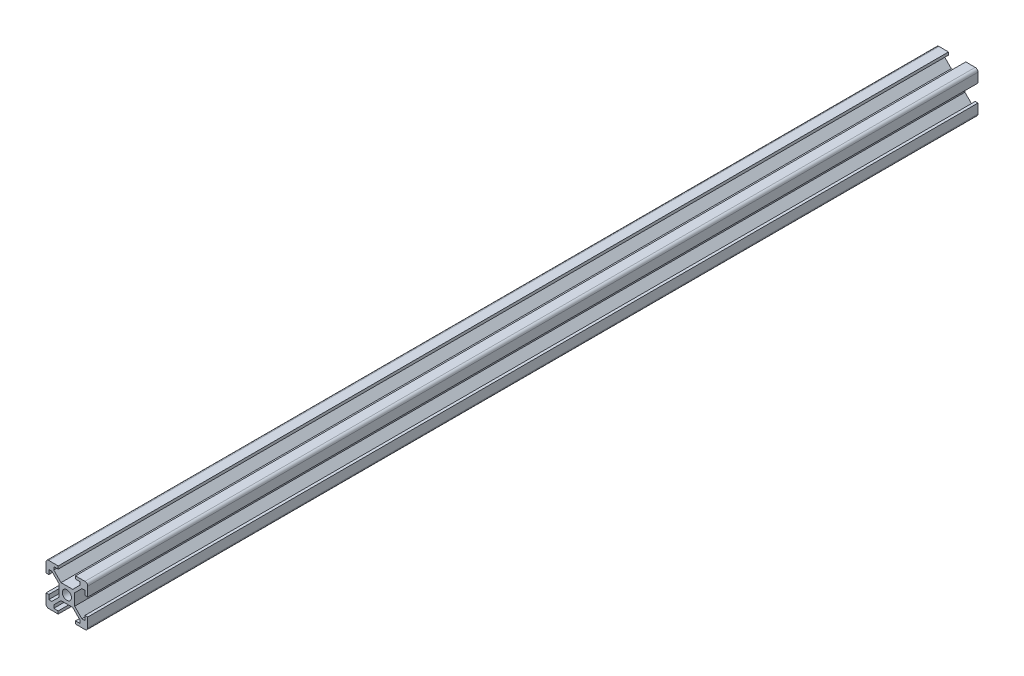
from build123d import *

# Parameters (mm, degrees)
SKETCH_2_R      = 1.65
EXTRUDE_1_DEPTH = 160


with BuildPart() as part:
    # 草图2 → 凸台-拉伸1 (new, symmetric)
    with BuildSketch(Plane.XY):
        with BuildLine():
            Line((-2.092893219, -2.8), (-4.7, -5.407106781))
            Line((-4.7, -5.407106781), (-4.7, -6.5))
            Line((-4.7, -6.5), (-3.1, -6.5))
            Line((-3.1, -6.5), (-3.1, -7.5))
            Line((-3.1, -7.5), (-6.5, -7.5))
            ThreePointArc((-6.5, -7.5), (-7.207106781, -7.207106781), (-7.5, -6.5))
            Line((-7.5, -6.5), (-7.5, -3.1))
            Line((-7.5, -3.1), (-6.5, -3.1))
            Line((-6.5, -3.1), (-6.5, -4.7))
            Line((-6.5, -4.7), (-5.407106781, -4.7))
            Line((-5.407106781, -4.7), (-2.8, -2.092893219))
            Line((-2.8, -2.092893219), (-2.8, 2.092893219))
            Line((-2.8, 2.092893219), (-5.407106781, 4.7))
            Line((-5.407106781, 4.7), (-6.5, 4.7))
            Line((-6.5, 4.7), (-6.5, 3.1))
            Line((-6.5, 3.1), (-7.5, 3.1))
            Line((-7.5, 3.1), (-7.5, 6.5))
            ThreePointArc((-7.5, 6.5), (-7.207106781, 7.207106781), (-6.5, 7.5))
            Line((-6.5, 7.5), (-3.1, 7.5))
            Line((-3.1, 7.5), (-3.1, 6.5))
            Line((-3.1, 6.5), (-4.7, 6.5))
            Line((-4.7, 6.5), (-4.7, 5.407106781))
            Line((-4.7, 5.407106781), (-2.092893219, 2.8))
            Line((-2.092893219, 2.8), (2.092893219, 2.8))
            Line((2.092893219, 2.8), (4.7, 5.407106781))
            Line((4.7, 5.407106781), (4.7, 6.5))
            Line((4.7, 6.5), (3.1, 6.5))
            Line((3.1, 6.5), (3.1, 7.5))
            Line((3.1, 7.5), (6.5, 7.5))
            ThreePointArc((6.5, 7.5), (7.207106781, 7.207106781), (7.5, 6.5))
            Line((7.5, 6.5), (7.5, 3.1))
            Line((7.5, 3.1), (6.5, 3.1))
            Line((6.5, 3.1), (6.5, 4.7))
            Line((6.5, 4.7), (5.407106781, 4.7))
            Line((5.407106781, 4.7), (2.8, 2.092893219))
            Line((2.8, 2.092893219), (2.8, -2.092893219))
            Line((2.8, -2.092893219), (5.407106781, -4.7))
            Line((5.407106781, -4.7), (6.5, -4.7))
            Line((6.5, -4.7), (6.5, -3.1))
            Line((6.5, -3.1), (7.5, -3.1))
            Line((7.5, -3.1), (7.5, -6.5))
            ThreePointArc((7.5, -6.5), (7.207106781, -7.207106781), (6.5, -7.5))
            Line((6.5, -7.5), (3.1, -7.5))
            Line((3.1, -7.5), (3.1, -6.5))
            Line((3.1, -6.5), (4.7, -6.5))
            Line((4.7, -6.5), (4.7, -5.407106781))
            Line((4.7, -5.407106781), (2.092893219, -2.8))
            Line((2.092893219, -2.8), (-2.092893219, -2.8))
        make_face()
        Circle(SKETCH_2_R, mode=Mode.SUBTRACT)
    extrude(amount=EXTRUDE_1_DEPTH, both=True)


solid = part.part
